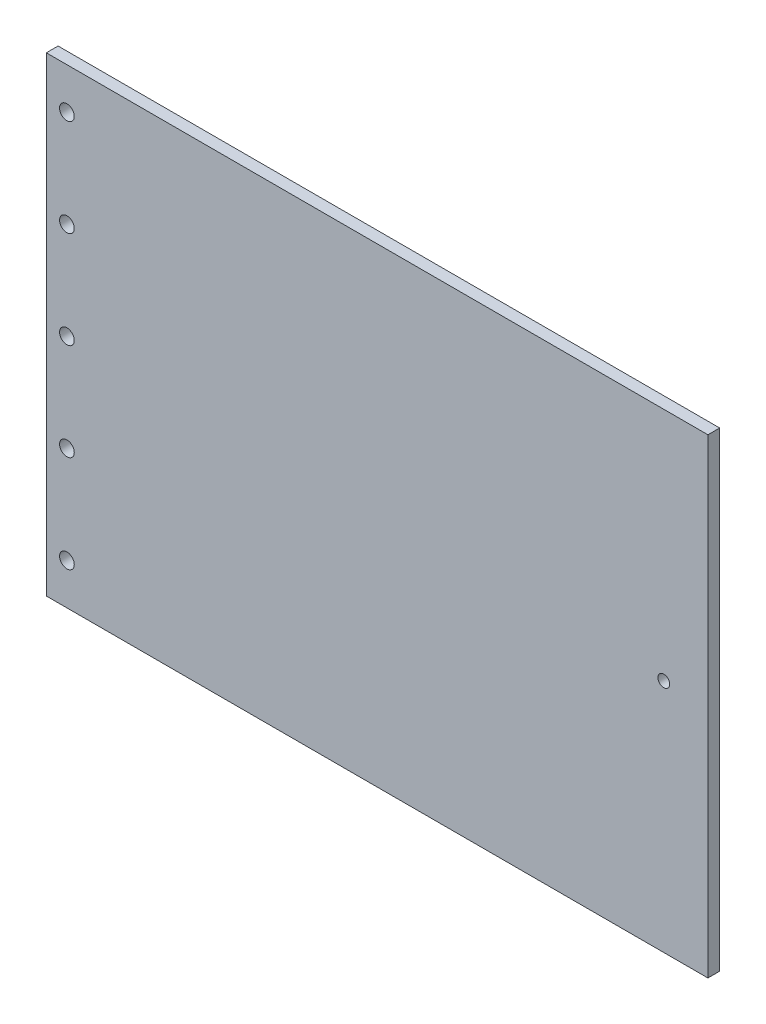
from build123d import *

# Parameters (mm, degrees)
SKETCH_1_W          = 225
SKETCH_1_H          = 160
SKETCH_1_R          = 2.5
EXTRUDE_1_DEPTH     = 4
SKETCH_2_R          = 2
CUT_EXTRUDE_1_DEPTH = 277.117728514


with BuildPart() as part:
    # Эскиз1 → Бобышка-Вытянуть1 (new body)
    with BuildSketch(Plane.XY):
        with Locations((112.5, 80)):
            Rectangle(SKETCH_1_W, SKETCH_1_H)
        with Locations((7, 80)):
            Circle(SKETCH_1_R, mode=Mode.SUBTRACT)
        with Locations((7, 47)):
            Circle(SKETCH_1_R, mode=Mode.SUBTRACT)
        with Locations((7, 14)):
            Circle(SKETCH_1_R, mode=Mode.SUBTRACT)
        with Locations((7, 113)):
            Circle(SKETCH_1_R, mode=Mode.SUBTRACT)
        with Locations((7, 146)):
            Circle(SKETCH_1_R, mode=Mode.SUBTRACT)
    extrude(amount=EXTRUDE_1_DEPTH)

    # Эскиз2 → Вырез-Вытянуть1 (cut, through all)
    with BuildSketch(Plane.XY.offset(4)):
        with Locations((210, 80)):
            Circle(SKETCH_2_R)
    extrude(amount=-CUT_EXTRUDE_1_DEPTH, mode=Mode.SUBTRACT)


solid = part.part
